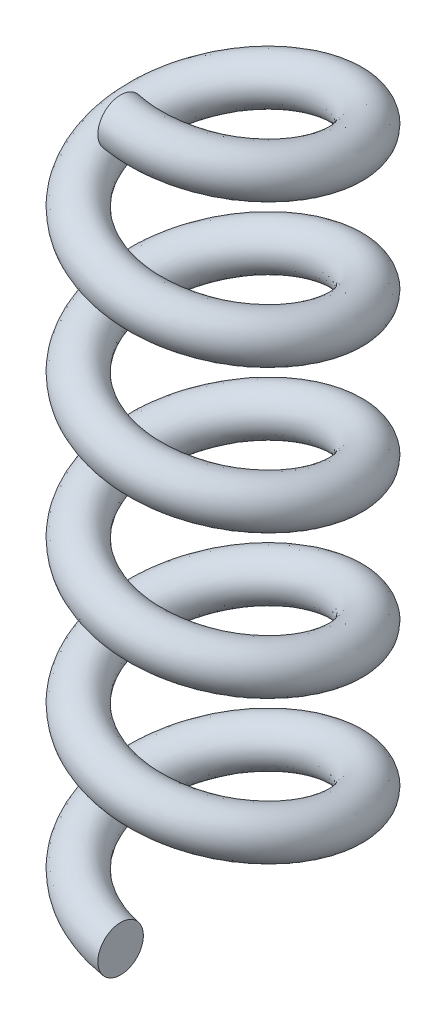
from build123d import *

# Parameters (mm, degrees)
SWEEP_1_PITCH  = 6.3
SWEEP_1_HEIGHT = 31.5
SWEEP_1_RADIUS = 4.5
SKETCH_2_R     = 1


with BuildPart() as part:
    # 扫描1: sweep along a helix
    with BuildLine() as sweep_1_path:
        Helix(SWEEP_1_PITCH, SWEEP_1_HEIGHT, SWEEP_1_RADIUS, center=(0, 0, 0), direction=(0, 1, 0), lefthand=True)
    # 草图2 → 扫描1 (sweep)
    with BuildSketch(Plane(origin=(0, 0, 0), x_dir=(0, 0, -1), z_dir=(1, 0, 0))):
        with Locations((-4.5, 0)):
            Circle(SKETCH_2_R)
    sweep(path=sweep_1_path.line, is_frenet=True)


solid = part.part
